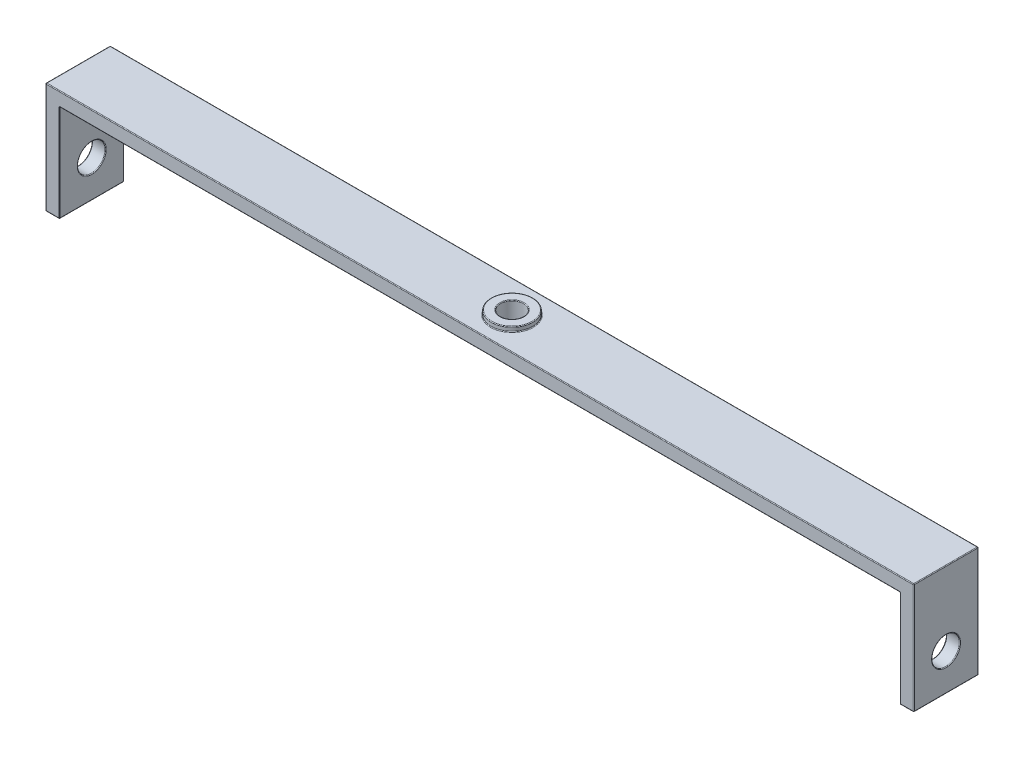
from build123d import *

# Parameters (mm, degrees)
BOSS_EXTRUDE1_DEPTH            = 3.5
BOSS_EXTRUDE1_DEPTH_BACK       = 3.5
SKETCH2_R                      = 1.25
CUT_EXTRUDE1_DEPTH             = 1.5
BOSS_EXTRUDE2_START            = 0.5
SKETCH3_R                      = 2.25
SKETCH3_R_2                    = 1.25
BOSS_EXTRUDE2_DEPTH            = 0.5
CUT_EXTRUDE2_REACH             = 50.634
SKETCH4_R                      = 1.5
CUT_EXTRUDE2_DIRECTION_2_REACH = 50.634
FILLET1_R                      = 0.075


with BuildPart() as part:
    # Sketch1 → Boss-Extrude1 (new, two sides: drawn at the far end of the back side and taken through both)
    with BuildSketch(Plane.XY.offset(-BOSS_EXTRUDE1_DEPTH_BACK)):
        Polygon((-47, 0), (47, 0), (47, -12), (45.5, -12), (45.5, -1.5), (-45.5, -1.5), (-45.5, -12), (-47, -12), align=None)
    extrude(amount=BOSS_EXTRUDE1_DEPTH + BOSS_EXTRUDE1_DEPTH_BACK)

    # Sketch2 → Cut-Extrude1 (cut)
    with BuildSketch(Plane(origin=(0, 0, 0), x_dir=(1, 0, 0), z_dir=(0, 1, 0))):
        with Locations(Location((0, 0, 0), (0, 0, 180))):
            Circle(SKETCH2_R)
    extrude(amount=-CUT_EXTRUDE1_DEPTH, mode=Mode.SUBTRACT)

    # Sketch3 → Boss-Extrude2 (add)
    with BuildSketch(Plane(origin=(0, 0, 0), x_dir=(1, 0, 0), z_dir=(0, 1, 0)).offset(BOSS_EXTRUDE2_START)):
        with Locations(Location((0, 0, 0), (0, 0, 180))):
            Circle(SKETCH3_R)
        with Locations(Location((0, 0, 0), (0, 0, 180))):
            Circle(SKETCH3_R_2, mode=Mode.SUBTRACT)
    extrude(amount=-BOSS_EXTRUDE2_DEPTH)

    # Cut-Extrude2: up to this face of the body (flat: up to its plane)
    cut_extrude2_end = Plane(part.part.faces().sort_by_distance((-47, -6, 0))[0])
    # Sketch4 → Cut-Extrude2 (cut, up to the picked face)
    with BuildSketch(Plane(origin=(0, 0, 0), x_dir=(0, 0, -1), z_dir=(1, 0, 0)), mode=Mode.PRIVATE) as cut_extrude2_sk1:
        with Locations((0, -8)):
            Circle(SKETCH4_R)
    cut_extrude2_tool1 = split(extrude(cut_extrude2_sk1.sketch, amount=-CUT_EXTRUDE2_REACH, mode=Mode.PRIVATE), bisect_by=cut_extrude2_end, keep=Keep.BOTH, mode=Mode.PRIVATE)
    add(cut_extrude2_tool1.solids().sort_by(Axis((0, -8, 0), (-1, 0, 0)))[0], mode=Mode.SUBTRACT)

    # Cut-Extrude2 direction 2: up to this face of the body (flat: up to its plane)
    cut_extrude2_direction_2_end = Plane(part.part.faces().sort_by_distance((47, -6, 0))[0])
    # Sketch4 → Cut-Extrude2 direction 2 (cut, up to the picked face)
    with BuildSketch(Plane(origin=(0, 0, 0), x_dir=(0, 0, -1), z_dir=(1, 0, 0)), mode=Mode.PRIVATE) as cut_extrude2_direction_2_sk1:
        with Locations((0, -8)):
            Circle(SKETCH4_R)
    cut_extrude2_direction_2_tool1 = split(extrude(cut_extrude2_direction_2_sk1.sketch, amount=CUT_EXTRUDE2_DIRECTION_2_REACH, mode=Mode.PRIVATE), bisect_by=cut_extrude2_direction_2_end, keep=Keep.BOTH, mode=Mode.PRIVATE)
    add(cut_extrude2_direction_2_tool1.solids().sort_by(Axis((0, -8, 0), (1, 0, 0)))[0], mode=Mode.SUBTRACT)

    # Fillet1
    fillet1_edges = [part.edges().sort_by_distance(p)[0] for p in [
        (-45.5, -6.75, -3.5),
        (-47, 0, 0),
        (47, 0, 0),
        (47, -12, 0),
        (45.5, -12, 0),
        (45.5, -1.5, 0),
        (-45.5, -1.5, 0),
        (-45.5, -12, 0),
        (-47, -12, 0),
        (0, -1.5, -3.5),
        (45.5, -6.75, -3.5),
        (-47, -6, 3.5),
        (-46.25, -12, 3.5),
        (-45.5, -6.75, 3.5),
        (0, -1.5, 3.5),
        (45.5, -6.75, 3.5),
        (46.25, -12, -3.5),
        (46.25, -12, 3.5),
        (47, -6, 3.5),
        (0, 0, 3.5),
        (47, -6, -3.5),
        (0, 0, -3.5),
        (1.25, -1.5, 0),
        (2.25, 0.5, 0),
        (2.25, 0, 0),
        (1.25, 0.5, 0),
        (-47, -6, -3.5),
        (-45.5, -8, 1.5),
        (45.5, -8, 1.5),
        (-47, -8, 1.5),
        (47, -8, 1.5),
        (-46.25, -12, -3.5),
    ]]
    fillet(fillet1_edges, radius=FILLET1_R)


solid = part.part
